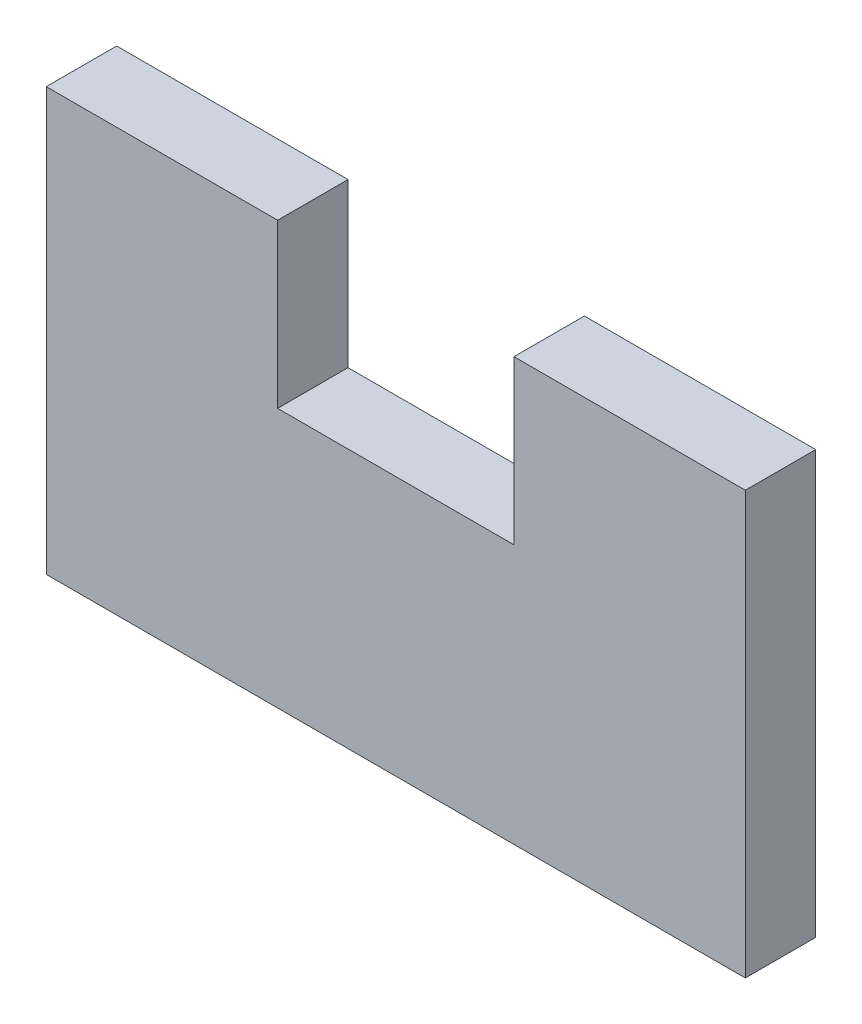
from build123d import *

# Parameters (mm, degrees)
BOSS_EXTRUDE1_DEPTH = 7


with BuildPart() as part:
    # Sketch1 → Boss-Extrude1 (new body)
    with BuildSketch(Plane.XY):
        Polygon((38.176534756, 19.170344417), (61.176534756, 19.170344417), (61.176534756, -22.829655583), (-8.323465244, -22.829655583), (-8.323465244, 19.170344417), (14.676534756, 19.170344417), (14.676534756, 2.970344417), (38.176534756, 2.970344417), align=None)
    extrude(amount=BOSS_EXTRUDE1_DEPTH)


solid = part.part
